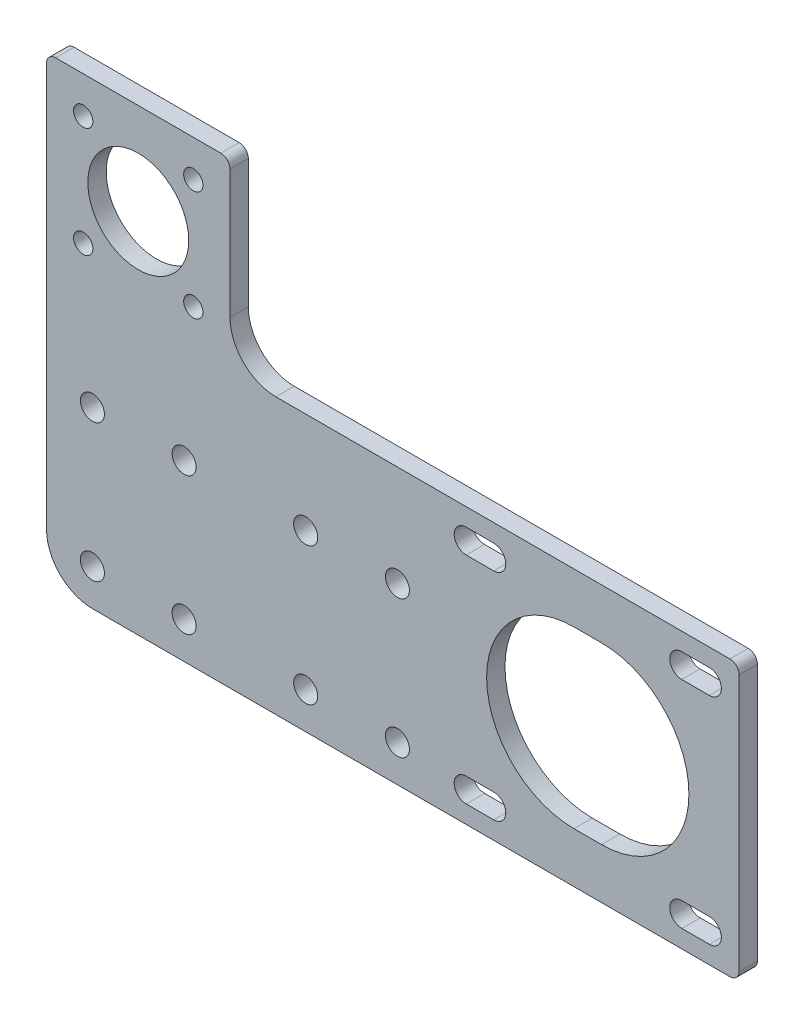
from build123d import *

# Parameters (mm, degrees)
MODEL_R         = 11
MODEL_R_2       = 2.1
MODEL_R_3       = 2.625
EXTRUDE_1_DEPTH = 4


with BuildPart() as part:
    # Model → 凸台-拉伸1 (new body)
    with BuildSketch(Plane.XY):
        with BuildLine():
            Line((-80, 70), (-116, 70))
            ThreePointArc((-116, 70), (-117.414213562, 69.414213562), (-118, 68))
            Line((-118, 68), (-118, -20))
            ThreePointArc((-118, -20), (-115.071067812, -27.071067812), (-108, -30))
            Line((-108, -30), (31, -30))
            ThreePointArc((31, -30), (32.414213562, -29.414213562), (33, -28))
            Line((33, -28), (33, 28))
            ThreePointArc((33, 28), (32.414213562, 29.414213562), (31, 30))
            Line((31, 30), (-68, 30))
            ThreePointArc((-68, 30), (-75.071067812, 32.928932188), (-78, 40))
            Line((-78, 40), (-78, 68))
            ThreePointArc((-78, 68), (-78.585786438, 69.414213562), (-80, 70))
        make_face()
        with Locations((-98, 50)):
            Circle(MODEL_R, mode=Mode.SUBTRACT)
        with Locations((-110, 62)):
            Circle(MODEL_R_2, mode=Mode.SUBTRACT)
        with Locations((-86, 62)):
            Circle(MODEL_R_2, mode=Mode.SUBTRACT)
        with Locations((-110, 38)):
            Circle(MODEL_R_2, mode=Mode.SUBTRACT)
        with Locations((-86, 38)):
            Circle(MODEL_R_2, mode=Mode.SUBTRACT)
        with Locations((-61.5, 8)):
            Circle(MODEL_R_3, mode=Mode.SUBTRACT)
        with Locations((-41.5, 8)):
            Circle(MODEL_R_3, mode=Mode.SUBTRACT)
        with Locations((-41.5, -22)):
            Circle(MODEL_R_3, mode=Mode.SUBTRACT)
        with Locations((-61.5, -22)):
            Circle(MODEL_R_3, mode=Mode.SUBTRACT)
        with Locations((-108, 8)):
            Circle(MODEL_R_3, mode=Mode.SUBTRACT)
        with Locations((-88, 8)):
            Circle(MODEL_R_3, mode=Mode.SUBTRACT)
        with Locations((-108, -22)):
            Circle(MODEL_R_3, mode=Mode.SUBTRACT)
        with Locations((-88, -22)):
            Circle(MODEL_R_3, mode=Mode.SUBTRACT)
        with BuildLine():
            Line((-20.5, -20.875), (-26.5, -20.875))
            ThreePointArc((-26.5, -20.875), (-29.125, -23.5), (-26.5, -26.125))
            Line((-26.5, -26.125), (-20.5, -26.125))
            ThreePointArc((-20.5, -26.125), (-17.875, -23.5), (-20.5, -20.875))
        make_face(mode=Mode.SUBTRACT)
        with BuildLine():
            Line((20.5, 20.875), (26.5, 20.875))
            ThreePointArc((26.5, 20.875), (29.125, 23.5), (26.5, 26.125))
            Line((26.5, 26.125), (20.5, 26.125))
            ThreePointArc((20.5, 26.125), (17.875, 23.5), (20.5, 20.875))
        make_face(mode=Mode.SUBTRACT)
        with BuildLine():
            Line((-3, -19.05), (3, -19.05))
            ThreePointArc((3, -19.05), (22.05, 0), (3, 19.05))
            Line((3, 19.05), (-3, 19.05))
            ThreePointArc((-3, 19.05), (-22.05, 0), (-3, -19.05))
        make_face(mode=Mode.SUBTRACT)
        with BuildLine():
            Line((-26.5, 20.875), (-20.5, 20.875))
            ThreePointArc((-20.5, 20.875), (-17.875, 23.5), (-20.5, 26.125))
            Line((-20.5, 26.125), (-26.5, 26.125))
            ThreePointArc((-26.5, 26.125), (-29.125, 23.5), (-26.5, 20.875))
        make_face(mode=Mode.SUBTRACT)
        with BuildLine():
            Line((26.5, -20.875), (20.5, -20.875))
            ThreePointArc((20.5, -20.875), (17.875, -23.5), (20.5, -26.125))
            Line((20.5, -26.125), (26.5, -26.125))
            ThreePointArc((26.5, -26.125), (29.125, -23.5), (26.5, -20.875))
        make_face(mode=Mode.SUBTRACT)
    extrude(amount=EXTRUDE_1_DEPTH)


solid = part.part
